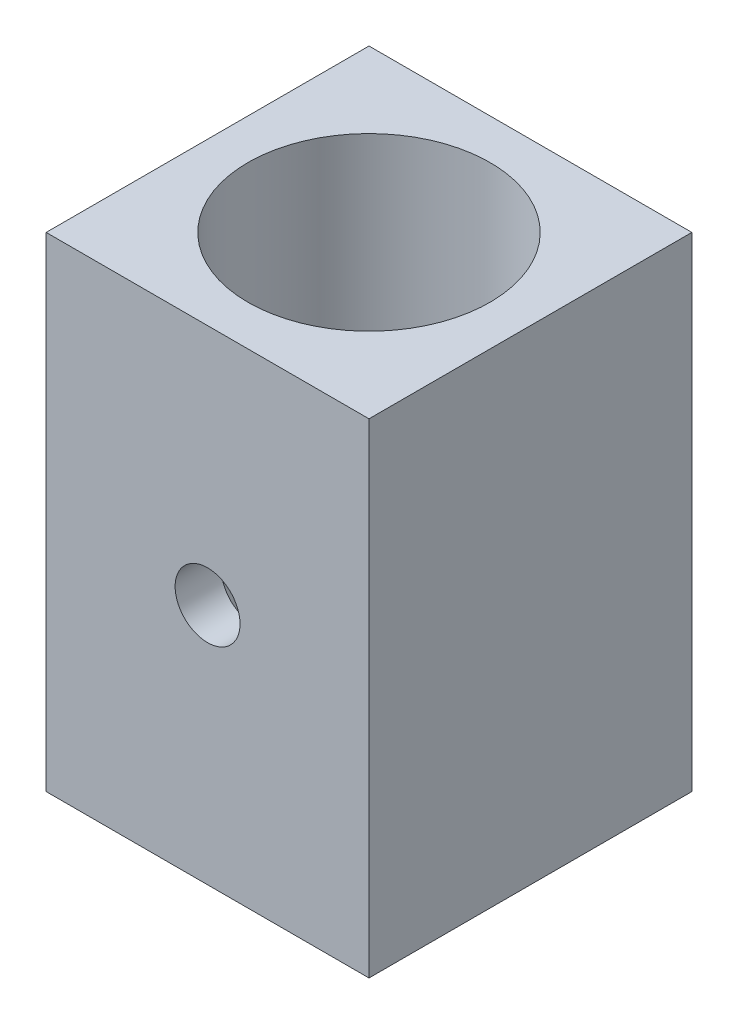
from build123d import *

# Parameters (mm, degrees)
SKETCH1_W                        = 25.4
SKETCH1_H                        = 25.4
SKETCH1_R                        = 9.525
BOSS_EXTRUDE1_DEPTH              = 38.1
TAP_DRILL_FOR_1_4_20_TAP1_REACH  = 54.363
TAP_DRILL_FOR_1_4_20_TAP1_BORE_R = 2.5527


with BuildPart() as part:
    # Sketch1 → Boss-Extrude1 (new body)
    with BuildSketch(Plane(origin=(0, 0, 0), x_dir=(1, 0, 0), z_dir=(0, 1, 0))):
        with Locations((12.7, 12.7)):
            Rectangle(SKETCH1_W, SKETCH1_H)
        with Locations(Location((12.7, 12.7, 0), (0, 0, 90))):
            Circle(SKETCH1_R, mode=Mode.SUBTRACT)
    extrude(amount=BOSS_EXTRUDE1_DEPTH)

    # Tap Drill for 1/4-20 Tap1 bore → Tap Drill for 1/4-20 Tap1 (cut, up to next)
    with BuildSketch(Plane.XY, mode=Mode.PRIVATE) as tap_drill_for_1_4_20_tap1_sk1:
        with Locations((12.7, 19.05)):
            Circle(TAP_DRILL_FOR_1_4_20_TAP1_BORE_R)
    tap_drill_for_1_4_20_tap1_tool1 = extrude(tap_drill_for_1_4_20_tap1_sk1.sketch, amount=-TAP_DRILL_FOR_1_4_20_TAP1_REACH, mode=Mode.PRIVATE) & part.part
    add(tap_drill_for_1_4_20_tap1_tool1.solids().sort_by_distance((12.7, 19.05, 0))[0], mode=Mode.SUBTRACT)


solid = part.part
